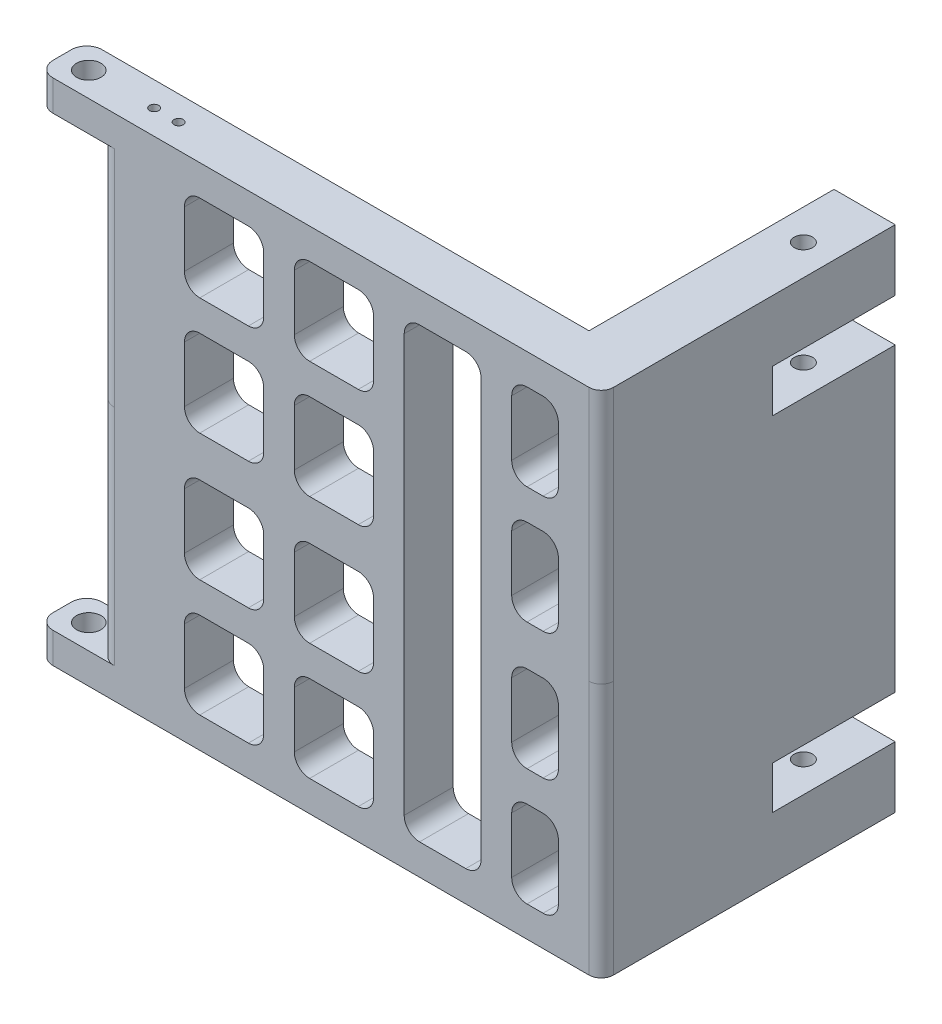
from build123d import *

# Parameters (mm, degrees)
ESBO_O2_W                = 82
ESBO_O2_H                = 41.55
RESSALTO_EXTRUS_O1_DEPTH = 8
ESBO_O3_R                = 0.75
CORTE_EXTRUS_O1_DEPTH    = 80.4806199
ESBO_O7_W                = 40
ESBO_O7_H                = 41.55
RESSALTO_EXTRUS_O2_DEPTH = 10
FILETE1_R                = 2
CORTE_EXTRUS_O3_START    = -8
CORTE_EXTRUS_O3_DEPTH    = 98.795934894
ESBO_O12_W               = 20
ESBO_O12_H               = 7
CORTE_EXTRUS_O4_DEPTH    = 10
ESBO_O19_R               = 1.5
CORTE_EXTRUS_O7_DEPTH    = 89.61810729
ESBO_O17_W               = 10
ESBO_O17_H               = 5
RESSALTO_EXTRUS_O4_DEPTH = 8
ESBO_O20_R               = 2
CORTE_EXTRUS_O9_DEPTH    = 8
FILETE2_R                = 2.5
FILETE3_R                = 2.5
FILETE4_R                = 2.5
FILETE5_R                = 2.5
FILETE1_OF_ESPELHAR5_R   = 2
FILETE2_OF_ESPELHAR5_R   = 2.5
FILETE3_OF_ESPELHAR5_R   = 2.5
FILETE4_OF_ESPELHAR5_R   = 2.5
FILETE5_OF_ESPELHAR5_R   = 2.5


with BuildPart() as part:
    # Esboço2 → Ressalto-extrusão1 (new body)
    with BuildSketch(Plane.XY):
        with Locations((-26.281248797, -14.332598663)):
            Rectangle(ESBO_O2_W, ESBO_O2_H)
    ressalto_extrus_o1 = extrude(amount=RESSALTO_EXTRUS_O1_DEPTH)

    # Esboço3 → Corte-extrusão1 (cut, through all)
    with BuildSketch(Plane(origin=(0, -35.107598663, 0), x_dir=(-1, 0, 0), z_dir=(0, -1, 0))):
        with Locations(Location((58.281248797, -4, 0), (0, 0, 90))):
            Circle(ESBO_O3_R)
        with Locations(Location((62.281248797, -4, 0), (0, 0, 90))):
            Circle(ESBO_O3_R)
    corte_extrus_o1 = extrude(amount=-CORTE_EXTRUS_O1_DEPTH, mode=Mode.SUBTRACT)

    # Esboço7 → Ressalto-extrusão2 (add)
    with BuildSketch(Plane(origin=(14.718751203, 0, 0), x_dir=(0, 0, -1), z_dir=(1, 0, 0))):
        with Locations((20, -14.332598663)):
            Rectangle(ESBO_O7_W, ESBO_O7_H)
    ressalto_extrus_o2 = extrude(amount=-RESSALTO_EXTRUS_O2_DEPTH)

    # Filete1
    filete1_edges = [part.edges().sort_by_distance(p)[0] for p in [
        (14.718751203, -14.332598663, 8),
    ]]
    fillet(filete1_edges, radius=FILETE1_R)

    # Esboço11 → Corte-extrusão3 (cut)
    with BuildSketch(Plane.XY.offset(8).offset(CORTE_EXTRUS_O3_START)):
        with BuildLine():
            Line((-50.831248797, -30.107598663), (-42.891248797, -30.107598663))
            ThreePointArc((-42.891248797, -30.107598663), (-41.123481844, -29.375365616), (-40.391248797, -27.607598663))
            Line((-40.391248797, -27.607598663), (-40.391248797, -18.487598663))
            ThreePointArc((-40.391248797, -18.487598663), (-41.123481844, -16.71983171), (-42.891248797, -15.987598663))
            Line((-42.891248797, -15.987598663), (-50.831248797, -15.987598663))
            ThreePointArc((-50.831248797, -15.987598663), (-52.59901575, -16.71983171), (-53.331248797, -18.487598663))
            Line((-53.331248797, -18.487598663), (-53.331248797, -27.607598663))
            ThreePointArc((-53.331248797, -27.607598663), (-52.59901575, -29.375365616), (-50.831248797, -30.107598663))
        make_face()
        with BuildLine():
            Line((-50.831248797, 3.132401337), (-42.891248797, 3.132401337))
            ThreePointArc((-42.891248797, 3.132401337), (-41.123481844, 2.40016829), (-40.391248797, 0.632401337))
            Line((-40.391248797, 0.632401337), (-40.391248797, -8.487598663))
            ThreePointArc((-40.391248797, -8.487598663), (-41.123481844, -10.255365616), (-42.891248797, -10.987598663))
            Line((-42.891248797, -10.987598663), (-50.831248797, -10.987598663))
            ThreePointArc((-50.831248797, -10.987598663), (-52.59901575, -10.255365616), (-53.331248797, -8.487598663))
            Line((-53.331248797, -8.487598663), (-53.331248797, 0.632401337))
            ThreePointArc((-53.331248797, 0.632401337), (-52.59901575, 2.40016829), (-50.831248797, 3.132401337))
        make_face()
        with BuildLine():
            Line((5.218751203, 3.132401337), (2.598751203, 3.132401337))
            ThreePointArc((2.598751203, 3.132401337), (0.83098425, 2.40016829), (0.098751203, 0.632401337))
            Line((0.098751203, 0.632401337), (0.098751203, -8.487598663))
            ThreePointArc((0.098751203, -8.487598663), (0.83098425, -10.255365616), (2.598751203, -10.987598663))
            Line((2.598751203, -10.987598663), (5.218751203, -10.987598663))
            ThreePointArc((5.218751203, -10.987598663), (6.986518156, -10.255365616), (7.718751203, -8.487598663))
            Line((7.718751203, -8.487598663), (7.718751203, 0.632401337))
            ThreePointArc((7.718751203, 0.632401337), (6.986518156, 2.40016829), (5.218751203, 3.132401337))
        make_face()
        with BuildLine():
            Line((5.218751203, -30.107598663), (2.598751203, -30.107598663))
            ThreePointArc((2.598751203, -30.107598663), (0.83098425, -29.375365616), (0.098751203, -27.607598663))
            Line((0.098751203, -27.607598663), (0.098751203, -18.487598663))
            ThreePointArc((0.098751203, -18.487598663), (0.83098425, -16.71983171), (2.598751203, -15.987598663))
            Line((2.598751203, -15.987598663), (5.218751203, -15.987598663))
            ThreePointArc((5.218751203, -15.987598663), (6.986518156, -16.71983171), (7.718751203, -18.487598663))
            Line((7.718751203, -18.487598663), (7.718751203, -27.607598663))
            ThreePointArc((7.718751203, -27.607598663), (6.986518156, -29.375365616), (5.218751203, -30.107598663))
        make_face()
        with BuildLine():
            Line((-4.901248797, 6.442401337), (-17.451248797, 6.442401337))
            Line((-17.451248797, 6.442401337), (-17.451248797, -27.607598663))
            ThreePointArc((-17.451248797, -27.607598663), (-16.71901575, -29.375365616), (-14.951248797, -30.107598663))
            Line((-14.951248797, -30.107598663), (-7.401248797, -30.107598663))
            ThreePointArc((-7.401248797, -30.107598663), (-5.633481844, -29.375365616), (-4.901248797, -27.607598663))
            Line((-4.901248797, -27.607598663), (-4.901248797, 6.442401337))
        make_face()
        with BuildLine():
            Line((-32.891248797, -30.107598663), (-24.951248797, -30.107598663))
            ThreePointArc((-24.951248797, -30.107598663), (-23.183481844, -29.375365616), (-22.451248797, -27.607598663))
            Line((-22.451248797, -27.607598663), (-22.451248797, -18.487598663))
            ThreePointArc((-22.451248797, -18.487598663), (-23.183481844, -16.71983171), (-24.951248797, -15.987598663))
            Line((-24.951248797, -15.987598663), (-32.891248797, -15.987598663))
            ThreePointArc((-32.891248797, -15.987598663), (-34.65901575, -16.71983171), (-35.391248797, -18.487598663))
            Line((-35.391248797, -18.487598663), (-35.391248797, -27.607598663))
            ThreePointArc((-35.391248797, -27.607598663), (-34.65901575, -29.375365616), (-32.891248797, -30.107598663))
        make_face()
        with BuildLine():
            Line((-32.891248797, 3.132401337), (-24.951248797, 3.132401337))
            ThreePointArc((-24.951248797, 3.132401337), (-23.183481844, 2.40016829), (-22.451248797, 0.632401337))
            Line((-22.451248797, 0.632401337), (-22.451248797, -8.487598663))
            ThreePointArc((-22.451248797, -8.487598663), (-23.183481844, -10.255365616), (-24.951248797, -10.987598663))
            Line((-24.951248797, -10.987598663), (-32.891248797, -10.987598663))
            ThreePointArc((-32.891248797, -10.987598663), (-34.65901575, -10.255365616), (-35.391248797, -8.487598663))
            Line((-35.391248797, -8.487598663), (-35.391248797, 0.632401337))
            ThreePointArc((-35.391248797, 0.632401337), (-34.65901575, 2.40016829), (-32.891248797, 3.132401337))
        make_face()
    corte_extrus_o3 = extrude(amount=CORTE_EXTRUS_O3_DEPTH, mode=Mode.SUBTRACT)

    # Esboço12 → Corte-extrusão4 (cut)
    with BuildSketch(Plane(origin=(14.718751203, 0, 0), x_dir=(0, 0, -1), z_dir=(1, 0, 0))):
        with Locations((30, -21.607598663)):
            Rectangle(ESBO_O12_W, ESBO_O12_H)
    corte_extrus_o4 = extrude(amount=-CORTE_EXTRUS_O4_DEPTH, mode=Mode.SUBTRACT)

    # Esboço19 → Corte-extrusão7 (cut, through all)
    with BuildSketch(Plane.XZ.offset(35.107598663)):
        with Locations(Location((9.718751203, -30, 0), (0, 0, 270))):
            Circle(ESBO_O19_R)
    corte_extrus_o7 = extrude(amount=-CORTE_EXTRUS_O7_DEPTH, mode=Mode.SUBTRACT)

    # Esboço17 → Ressalto-extrusão4 (add)
    with BuildSketch(Plane(origin=(0, 0, 0), x_dir=(-1, 0, 0), z_dir=(0, 0, -1))):
        with Locations((72.281248797, -32.607598663)):
            Rectangle(ESBO_O17_W, ESBO_O17_H)
    ressalto_extrus_o4 = extrude(amount=-RESSALTO_EXTRUS_O4_DEPTH)

    # Esboço20 → Corte-extrusão9 (cut)
    with BuildSketch(Plane.XZ.offset(35.107598663)):
        with Locations(Location((-72.951248797, 4, 0), (0, 0, 270))):
            Circle(ESBO_O20_R)
    corte_extrus_o9 = extrude(amount=-CORTE_EXTRUS_O9_DEPTH, mode=Mode.SUBTRACT)

    # Filete2
    filete2_edges = [part.edges().sort_by_distance(p)[0] for p in [
        (-67.281248797, -11.832598663, 8),
    ]]
    fillet(filete2_edges, radius=FILETE2_R)

    # Filete3
    filete3_edges = [part.edges().sort_by_distance(p)[0] for p in [
        (-67.281248797, -11.832598663, 0),
    ]]
    fillet(filete3_edges, radius=FILETE3_R)

    # Filete4
    filete4_edges = [part.edges().sort_by_distance(p)[0] for p in [
        (-77.281248797, -32.607598663, 8),
    ]]
    fillet(filete4_edges, radius=FILETE4_R)

    # Filete5
    filete5_edges = [part.edges().sort_by_distance(p)[0] for p in [
        (-77.281248797, -32.607598663, 0),
    ]]
    fillet(filete5_edges, radius=FILETE5_R)

    # Espelhar5: Ressalto-extrusão1, Corte-extrusão1, Ressalto-extrusão2, Corte-extrusão3, Corte-extrusão4, Corte-extrusão7, Ressalto-extrusão4, Corte-extrusão9 across plane
    add(ressalto_extrus_o1.mirror(Plane.ZX.offset(6.442401337)))
    add(corte_extrus_o1.mirror(Plane.ZX.offset(6.442401337)), mode=Mode.SUBTRACT)
    add(ressalto_extrus_o2.mirror(Plane.ZX.offset(6.442401337)))
    add(corte_extrus_o3.mirror(Plane.ZX.offset(6.442401337)), mode=Mode.SUBTRACT)
    add(corte_extrus_o4.mirror(Plane.ZX.offset(6.442401337)), mode=Mode.SUBTRACT)
    add(corte_extrus_o7.mirror(Plane.ZX.offset(6.442401337)), mode=Mode.SUBTRACT)
    add(ressalto_extrus_o4.mirror(Plane.ZX.offset(6.442401337)))
    add(corte_extrus_o9.mirror(Plane.ZX.offset(6.442401337)), mode=Mode.SUBTRACT)

    # Filete1 of Espelhar5
    filete1_of_espelhar5_edges = [part.edges().sort_by_distance(p)[0] for p in [
        (14.718751203, 27.217401337, 8),
    ]]
    fillet(filete1_of_espelhar5_edges, radius=FILETE1_OF_ESPELHAR5_R)

    # Filete2 of Espelhar5
    filete2_of_espelhar5_edges = [part.edges().sort_by_distance(p)[0] for p in [
        (-67.281248797, 24.717401337, 8),
    ]]
    fillet(filete2_of_espelhar5_edges, radius=FILETE2_OF_ESPELHAR5_R)

    # Filete3 of Espelhar5
    filete3_of_espelhar5_edges = [part.edges().sort_by_distance(p)[0] for p in [
        (-67.281248797, 24.717401337, 0),
    ]]
    fillet(filete3_of_espelhar5_edges, radius=FILETE3_OF_ESPELHAR5_R)

    # Filete4 of Espelhar5
    filete4_of_espelhar5_edges = [part.edges().sort_by_distance(p)[0] for p in [
        (-77.281248797, 45.492401337, 8),
    ]]
    fillet(filete4_of_espelhar5_edges, radius=FILETE4_OF_ESPELHAR5_R)

    # Filete5 of Espelhar5
    filete5_of_espelhar5_edges = [part.edges().sort_by_distance(p)[0] for p in [
        (-77.281248797, 45.492401337, 0),
    ]]
    fillet(filete5_of_espelhar5_edges, radius=FILETE5_OF_ESPELHAR5_R)


solid = part.part
